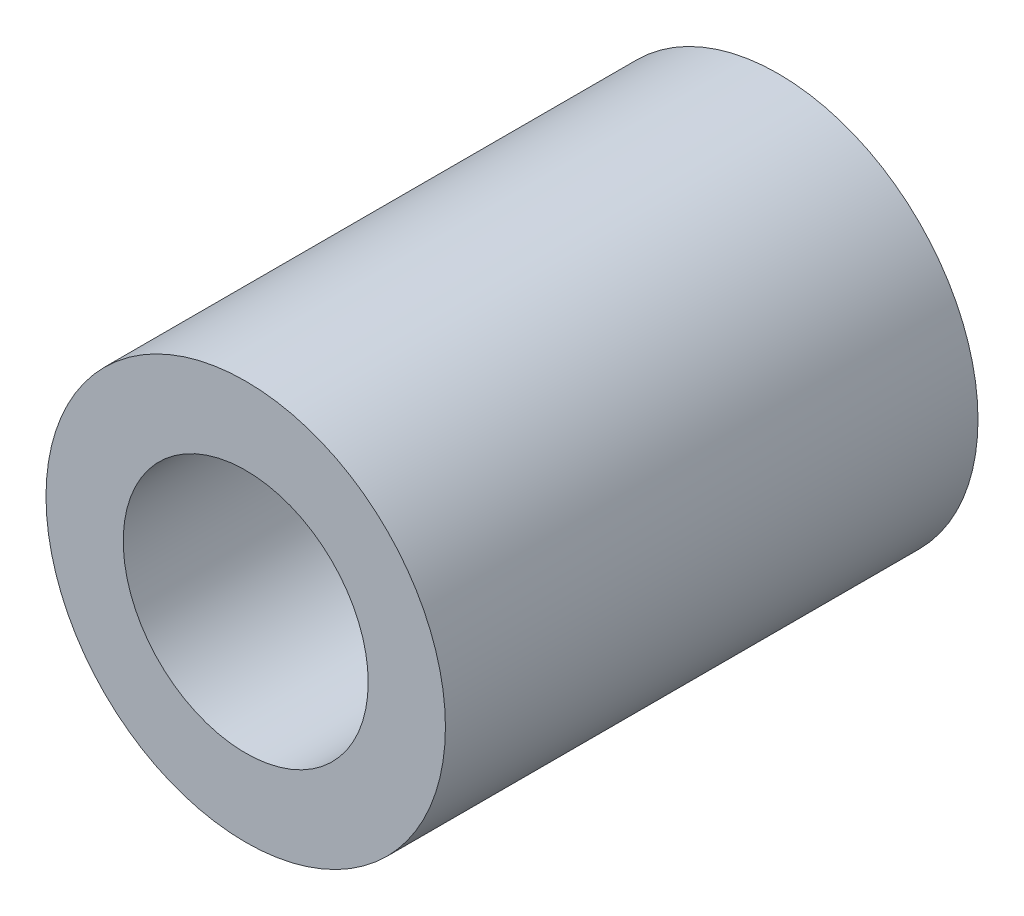
from build123d import *

# Parameters (mm, degrees)
SKETCH1_R      = 2.38125
SKETCH1_R_2    = 1.4605
EXTRUDE1_DEPTH = 3.175


with BuildPart() as part:
    # Sketch1 → Extrude1 (new, symmetric)
    with BuildSketch(Plane.XY):
        Circle(SKETCH1_R)
        Circle(SKETCH1_R_2, mode=Mode.SUBTRACT)
    extrude(amount=EXTRUDE1_DEPTH, both=True)


solid = part.part
